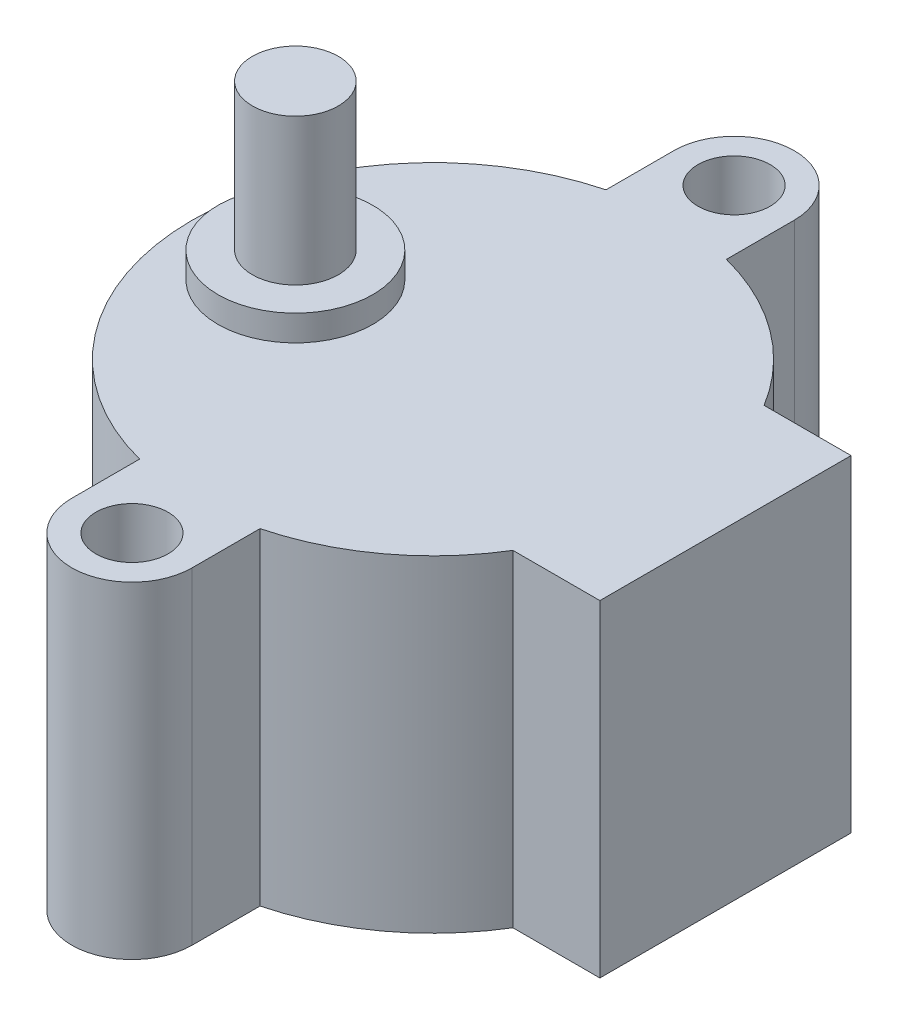
from build123d import *

# Parameters (mm, degrees)
SKETCH1_R           = 14
SKETCH1_R_2         = 2.1
SKETCH1_W           = 5.05387092
SKETCH1_H           = 14.6
BOSS_EXTRUDE1_DEPTH = 19
SKETCH2_R           = 4.5
BOSS_EXTRUDE2_DEPTH = 1.5
SKETCH3_R           = 2.5
BOSS_EXTRUDE3_DEPTH = 8.5


with BuildPart() as part:
    # Sketch1 → Boss-Extrude1 (new body)
    # profile 1 of 3: a face of its own
    with BuildSketch(Plane(origin=(0, 0, 0), x_dir=(1, 0, 0), z_dir=(0, 1, 0))):
        Circle(SKETCH1_R)
    # profile 2 of 3: a face of its own
    with BuildSketch(Plane(origin=(0, 0, 0), x_dir=(1, 0, 0), z_dir=(0, 1, 0))):
        with BuildLine():
            Line((-3.5, -17.5), (-3.5, 17.5))
            ThreePointArc((-3.5, 17.5), (0, 21), (3.5, 17.5))
            Line((3.5, 17.5), (3.5, -17.5))
            ThreePointArc((3.5, -17.5), (0, -21), (-3.5, -17.5))
        make_face()
        with Locations(Location((0, -17.5, 0), (0, 0, 270))):
            Circle(SKETCH1_R_2, mode=Mode.SUBTRACT)
        with Locations(Location((0, 17.5, 0), (0, 0, 270))):
            Circle(SKETCH1_R_2, mode=Mode.SUBTRACT)
    # profile 3 of 3: a face of its own
    with BuildSketch(Plane(origin=(0, 0, 0), x_dir=(1, 0, 0), z_dir=(0, 1, 0))):
        with Locations((14.47306454, 0)):
            Rectangle(SKETCH1_W, SKETCH1_H)
    extrude(amount=-BOSS_EXTRUDE1_DEPTH)

    # Sketch2 → Boss-Extrude2 (add)
    with BuildSketch(Plane(origin=(0, 0, 0), x_dir=(1, 0, 0), z_dir=(0, 1, 0))):
        with Locations(Location((-8, 0, 0), (0, 0, 270))):
            Circle(SKETCH2_R)
    extrude(amount=BOSS_EXTRUDE2_DEPTH)

    # Sketch3 → Boss-Extrude3 (add)
    with BuildSketch(Plane(origin=(0, 1.5, 0), x_dir=(1, 0, 0), z_dir=(0, 1, 0))):
        with Locations(Location((-8, 0, 0), (0, 0, 270))):
            Circle(SKETCH3_R)
    extrude(amount=BOSS_EXTRUDE3_DEPTH)


solid = part.part
